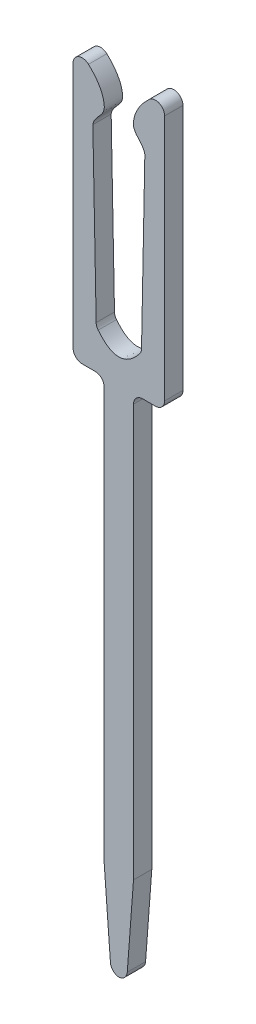
from build123d import *

# Parameters (mm, degrees)
BOSS_EXTRUDE1_DEPTH = 0.2


with BuildPart() as part:
    # Sketch1 → Boss-Extrude1 (new, symmetric)
    with BuildSketch(Plane.XY):
        with BuildLine():
            Line((-0.32, -7.733224852), (-0.32, 1.266775148))
            ThreePointArc((-0.32, 1.266775148), (-0.378578644, 1.408196504), (-0.52, 1.466775148))
            Line((-0.52, 1.466775148), (-0.8, 1.466775148))
            ThreePointArc((-0.8, 1.466775148), (-0.941421356, 1.525353792), (-1, 1.666775148))
            Line((-1, 1.666775148), (-1, 7.057198685))
            ThreePointArc((-1, 7.057198685), (-0.87939743, 7.240763518), (-0.663039519, 7.202944445))
            add(Edge.make_bspline(
                [(-0.663039519, 7.202944445), (-0.487599251, 7.038079386), (-0.326177604, 6.816155039), (-0.310671132, 6.388247389), (-0.548453888, 6.275984696), (-0.567669208, 6.108344969)],
                knots=[0.253308427, 0.253308427, 0.253308427, 0.253308427, 0.663171976, 0.707067436, 1, 1, 1, 1], degree=3))
            Line((-0.567669208, 6.108344969), (-0.495215905, 2.401684718))
            ThreePointArc((-0.495215905, 2.401684718), (-0.483221967, 2.337269967), (-0.451053839, 2.280188217))
            add(Edge.make_bspline(
                [(-0.451053839, 2.280188217), (0, 1.719811783), (0.451053839, 2.280188217)],
                knots=[0.043404734, 0.043404734, 0.043404734, 0.956595266, 0.956595266, 0.956595266], degree=2))
            ThreePointArc((0.451053839, 2.280188217), (0.483221967, 2.337269967), (0.495215905, 2.401684718))
            Line((0.495215905, 2.401684718), (0.567669208, 6.108344969))
            add(Edge.make_bspline(
                [(0.663039519, 7.202944445), (0.487599251, 7.038079386), (0.326177604, 6.816155039), (0.310671132, 6.388247389), (0.548453888, 6.275984696), (0.567669208, 6.108344969)],
                knots=[0.253308427, 0.253308427, 0.253308427, 0.253308427, 0.663171976, 0.707067436, 1, 1, 1, 1], degree=3))
            ThreePointArc((0.663039519, 7.202944445), (0.87939743, 7.240763518), (1, 7.057198685))
            Line((1, 7.057198685), (1, 1.666775148))
            ThreePointArc((1, 1.666775148), (0.941421356, 1.525353792), (0.8, 1.466775148))
            Line((0.8, 1.466775148), (0.52, 1.466775148))
            ThreePointArc((0.52, 1.466775148), (0.378578644, 1.408196504), (0.32, 1.266775148))
            Line((0.32, 1.266775148), (0.32, -7.733224852))
            Line((0.32, -7.733224852), (0.183878151, -9.548182842))
            ThreePointArc((0.183878151, -9.548182842), (0.126073555, -9.674431974), (0, -9.732618516))
            ThreePointArc((0, -9.732618516), (-0.126073555, -9.674431974), (-0.183878151, -9.548182842))
            Line((-0.183878151, -9.548182842), (-0.32, -7.733224852))
        make_face()
    extrude(amount=BOSS_EXTRUDE1_DEPTH, both=True)


solid = part.part
